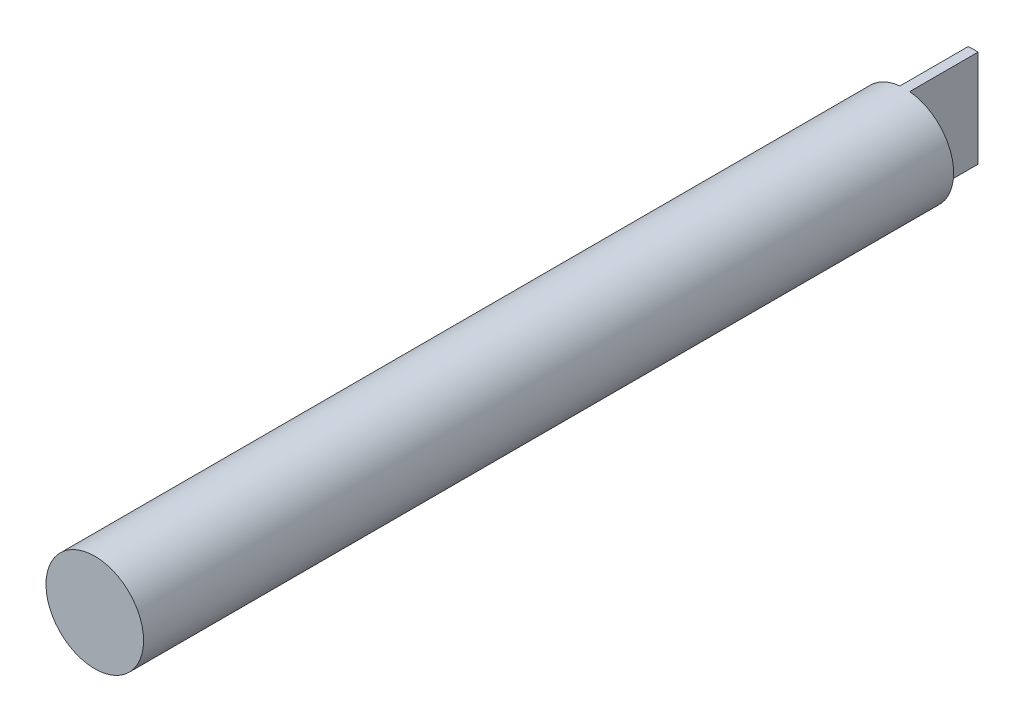
from build123d import *

# Parameters (mm, degrees)
ESBO_O1_R                = 5
RESSALTO_EXTRUS_O1_DEPTH = 45
SKETCH2_W                = 5
SKETCH2_H                = 10
CUT_EXTRUDE2_DEPTH       = 7


with BuildPart() as part:
    # Esboço1 → Ressalto-extrusão1 (new, symmetric)
    with BuildSketch(Plane.XY):
        with Locations(Location((208.88140452, 100, 0), (0, 0, 180))):
            Circle(ESBO_O1_R)
    extrude(amount=RESSALTO_EXTRUS_O1_DEPTH, both=True)

    # Sketch2 → Cut-Extrude2 (cut)
    with BuildSketch(Plane(origin=(0, 0, -45), x_dir=(-1, 0, 0), z_dir=(0, 0, -1))):
        with Locations((-205.88140452, 100)):
            Rectangle(SKETCH2_W, SKETCH2_H)
        with Locations((-211.88140452, 100)):
            Rectangle(SKETCH2_W, SKETCH2_H)
    extrude(amount=-CUT_EXTRUDE2_DEPTH, mode=Mode.SUBTRACT)


solid = part.part
